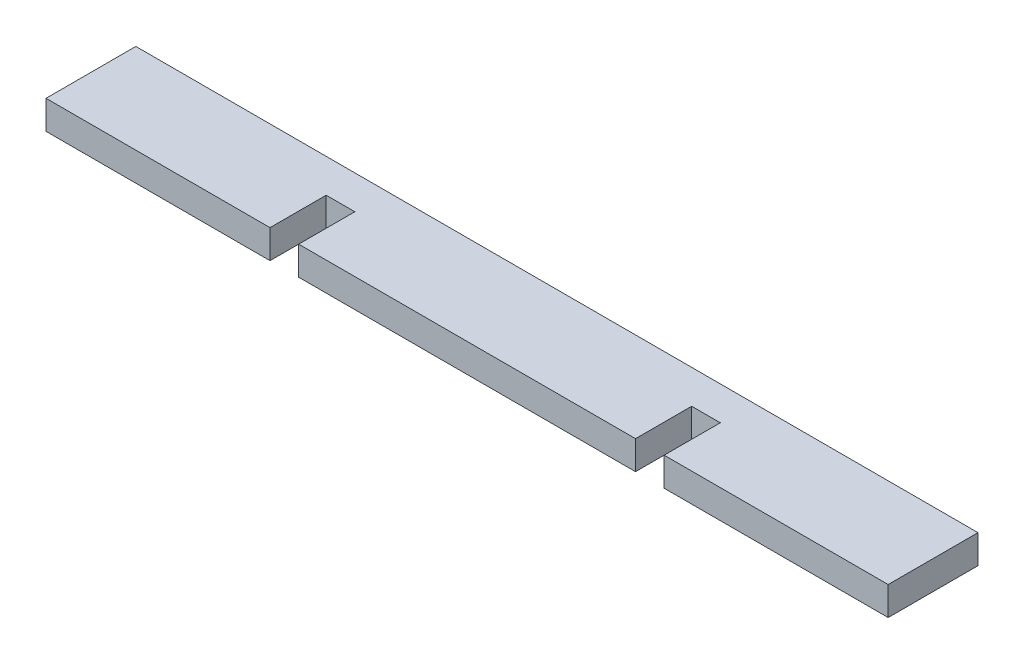
from build123d import *

# Parameters (mm, degrees)
BOSS_EXTRUDE1_DEPTH = 5.1


with BuildPart() as part:
    # Sketch1 → Boss-Extrude1 (new body)
    with BuildSketch(Plane(origin=(0, 0, 0), x_dir=(1, 0, 0), z_dir=(0, 1, 0))):
        Polygon((-35.1, -8), (-35.1, 2), (-30, 2), (-30, -8), (30, -8), (30, 2), (35.1, 2), (35.1, -8), (75, -8), (75, 8), (-75, 8), (-75, -8), align=None)
    extrude(amount=BOSS_EXTRUDE1_DEPTH)


solid = part.part
